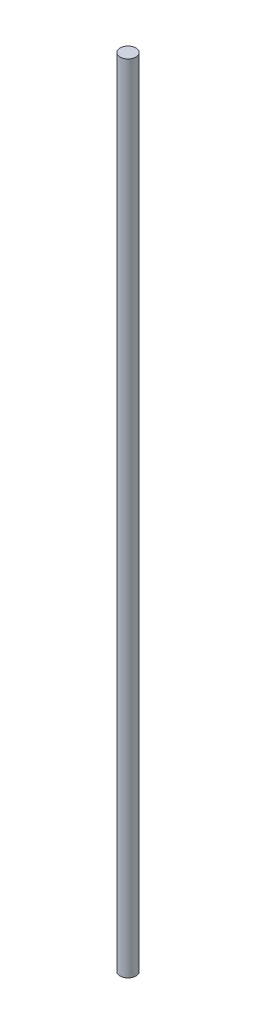
from build123d import *

# Parameters (mm, degrees)
SKETCH1_R           = 1
BOSS_EXTRUDE1_DEPTH = 100


with BuildPart() as part:
    # Sketch1 → Boss-Extrude1 (new body)
    with BuildSketch(Plane(origin=(0, 0, 0), x_dir=(1, 0, 0), z_dir=(0, 1, 0))):
        with Locations(Location((0, 0, 0), (0, 0, 270))):
            Circle(SKETCH1_R)
    extrude(amount=BOSS_EXTRUDE1_DEPTH)


solid = part.part
